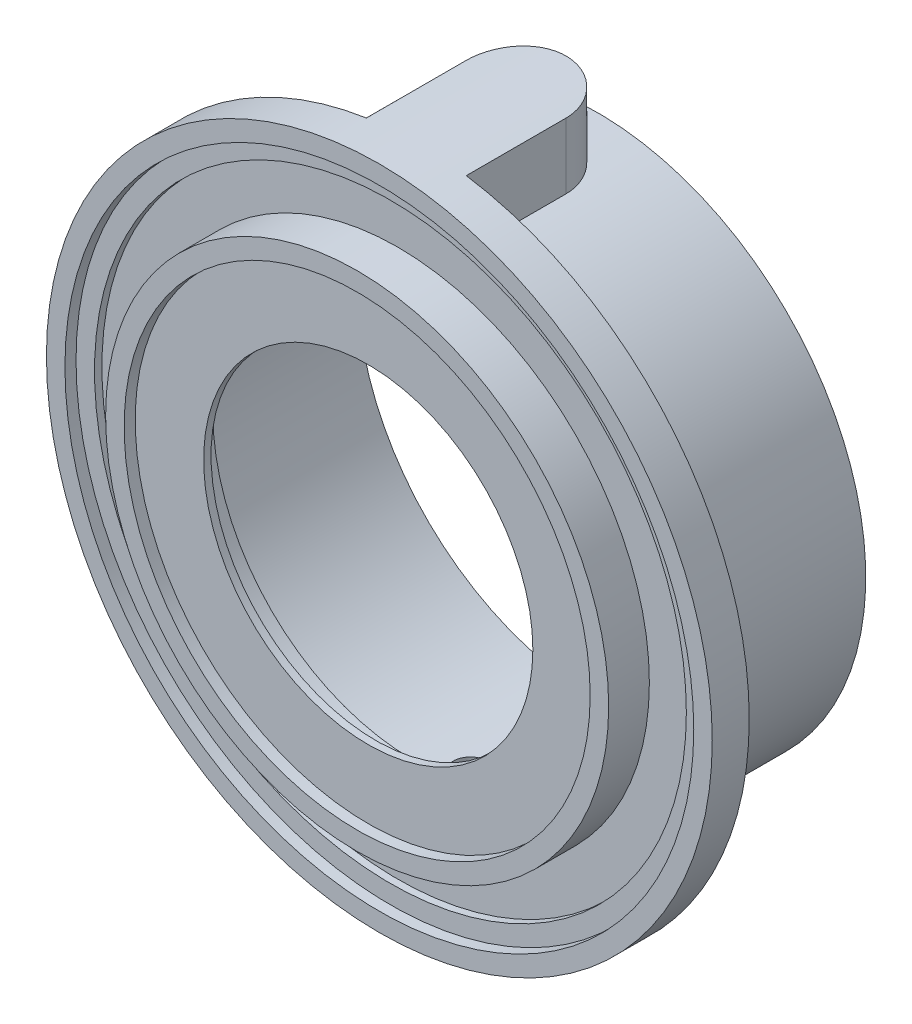
from build123d import *

# Parameters (mm, degrees)
SKETCH1_R                            = 9
SKETCH1_R_2                          = 4.45
BOSS_EXTRUDE1_DEPTH                  = 6.5
CUT_EXTRUDE1_START                   = -4.9
SKETCH2_R                            = 9
SKETCH2_R_2                          = 7.25
CUT_EXTRUDE1_DEPTH                   = 4.9
SKETCH4_R                            = 6.3
SKETCH4_R_2                          = 4.45
CUT_EXTRUDE2_DEPTH                   = 0.3
SKETCH5_R                            = 9
SKETCH5_R_2                          = 6.8
CUT_EXTRUDE3_DEPTH                   = 0.6
SKETCH6_R                            = 8.5
SKETCH6_R_2                          = 6.8
CUT_EXTRUDE4_DEPTH                   = 0.3
SKETCH7_R                            = 6.5
CUT_EXTRUDE5_DEPTH                   = 5
SKETCH8_R                            = 5.4
CUT_EXTRUDE6_DEPTH                   = 1
BOSS_EXTRUDE5_REACH                  = 21.68
BOSS_EXTRUDE5_END_RADIUS             = 9
BOSS_EXTRUDE5_DIRECTION_2_REACH      = 21.68
BOSS_EXTRUDE5_DIRECTION_2_END_RADIUS = 7.25
SKETCH11_R                           = 0.5
CUT_EXTRUDE7_DEPTH                   = 15.291606127
SKETCH12_R                           = 8
SKETCH12_R_2                         = 6.8
CUT_EXTRUDE8_DEPTH                   = 0.2


with BuildPart() as part:
    # Sketch1 → Boss-Extrude1 (new body)
    with BuildSketch(Plane.XY):
        Circle(SKETCH1_R)
        Circle(SKETCH1_R_2, mode=Mode.SUBTRACT)
    extrude(amount=-BOSS_EXTRUDE1_DEPTH)

    # Sketch2 → Cut-Extrude1 (cut)
    with BuildSketch(Plane(origin=(0, 0, -6.5), x_dir=(-1, 0, 0), z_dir=(0, 0, -1)).offset(CUT_EXTRUDE1_START)):
        with Locations(Location((0, 0, 0), (0, 0, 180))):
            Circle(SKETCH2_R)
        Circle(SKETCH2_R_2, mode=Mode.SUBTRACT)
    extrude(amount=CUT_EXTRUDE1_DEPTH, mode=Mode.SUBTRACT)

    # Sketch4 → Cut-Extrude2 (cut)
    with BuildSketch(Plane.XY):
        Circle(SKETCH4_R)
        Circle(SKETCH4_R_2, mode=Mode.SUBTRACT)
    extrude(amount=-CUT_EXTRUDE2_DEPTH, mode=Mode.SUBTRACT)

    # Sketch5 → Cut-Extrude3 (cut)
    with BuildSketch(Plane.XY):
        Circle(SKETCH5_R)
        Circle(SKETCH5_R_2, mode=Mode.SUBTRACT)
    extrude(amount=-CUT_EXTRUDE3_DEPTH, mode=Mode.SUBTRACT)

    # Sketch6 → Cut-Extrude4 (cut)
    with BuildSketch(Plane.XY.offset(-0.6)):
        Circle(SKETCH6_R)
        Circle(SKETCH6_R_2, mode=Mode.SUBTRACT)
    extrude(amount=-CUT_EXTRUDE4_DEPTH, mode=Mode.SUBTRACT)

    # Sketch7 → Cut-Extrude5 (cut)
    with BuildSketch(Plane(origin=(0, 0, -6.5), x_dir=(-1, 0, 0), z_dir=(0, 0, -1))):
        Circle(SKETCH7_R)
    extrude(amount=-CUT_EXTRUDE5_DEPTH, mode=Mode.SUBTRACT)

    # Sketch8 → Cut-Extrude6 (cut)
    with BuildSketch(Plane(origin=(0, 0, -1.5), x_dir=(-1, 0, 0), z_dir=(0, 0, -1))):
        Circle(SKETCH8_R)
    extrude(amount=-CUT_EXTRUDE6_DEPTH, mode=Mode.SUBTRACT)


with BuildPart() as body_2:
    # Boss-Extrude5: up to this cylinder (the profile starts inside it)
    boss_extrude5_end = Plane(origin=(0, 0, -3.492216), z_dir=(0, 0, 1)) * Cylinder(BOSS_EXTRUDE5_END_RADIUS, 62.36, mode=Mode.PRIVATE)
    # Sketch9 → Boss-Extrude5 (new, up to the surface)
    with BuildSketch(Plane(origin=(0, 7.25, 0), x_dir=(1, 0, 0), z_dir=(0, 1, 0)), mode=Mode.PRIVATE) as boss_extrude5_sk1:
        with BuildLine():
            Line((-1.35, 1.6), (-1.35, 4.3))
            ThreePointArc((-1.35, 4.3), (0, 5.65), (1.35, 4.3))
            Line((1.35, 4.3), (1.35, 1.6))
            Line((1.35, 1.6), (-1.35, 1.6))
        make_face()
    boss_extrude5_tool1 = extrude(boss_extrude5_sk1.sketch, amount=BOSS_EXTRUDE5_REACH, mode=Mode.PRIVATE) & boss_extrude5_end
    add(boss_extrude5_tool1.solids().sort_by_distance((0, 7.25, -3.492216))[0])

    # Boss-Extrude5 direction 2: up to this cylinder (the profile starts outside it)
    boss_extrude5_direction_2_end = Plane(origin=(0, 0, -3.492216), z_dir=(0, 0, -1)) * Cylinder(BOSS_EXTRUDE5_DIRECTION_2_END_RADIUS, 58.86, mode=Mode.PRIVATE)
    # Sketch9 → Boss-Extrude5 direction 2 (add, up to the surface)
    with BuildSketch(Plane(origin=(0, 7.25, 0), x_dir=(1, 0, 0), z_dir=(0, 1, 0)), mode=Mode.PRIVATE) as boss_extrude5_direction_2_sk1:
        with BuildLine():
            Line((-1.35, 1.6), (-1.35, 4.3))
            ThreePointArc((-1.35, 4.3), (0, 5.65), (1.35, 4.3))
            Line((1.35, 4.3), (1.35, 1.6))
            Line((1.35, 1.6), (-1.35, 1.6))
        make_face()
    boss_extrude5_direction_2_tool1 = extrude(boss_extrude5_direction_2_sk1.sketch, amount=-BOSS_EXTRUDE5_DIRECTION_2_REACH, mode=Mode.PRIVATE) - boss_extrude5_direction_2_end
    add(boss_extrude5_direction_2_tool1.solids().sort_by_distance((0, 7.25, -3.492216))[0])
    add(boss_extrude5_direction_2_tool1.solids().sort_by_distance((0, 7.25, -3.492216))[1])


with BuildPart() as body_3:
    # Mirror2: mirrored copy
    add(body_2.part.mirror(Plane.ZX))


with BuildPart() as body_2_1:
    add(body_2.part)

    # Combine3: union part, body 3
    add(part.part)
    add(body_3.part)

    # Sketch11 → Cut-Extrude7 (cut, through all)
    with BuildSketch(Plane(origin=(0, 0, 0), x_dir=(1, 0, 0), z_dir=(0, 1, 0))):
        with Locations(Location((0, 3.1, 0), (0, 0, 270))):
            Circle(SKETCH11_R)
    extrude(amount=-CUT_EXTRUDE7_DEPTH, mode=Mode.SUBTRACT)

    # Sketch12 → Cut-Extrude8 (cut)
    with BuildSketch(Plane.XY.offset(-0.9)):
        Circle(SKETCH12_R)
        Circle(SKETCH12_R_2, mode=Mode.SUBTRACT)
    extrude(amount=-CUT_EXTRUDE8_DEPTH, mode=Mode.SUBTRACT)


solid = body_2_1.part
